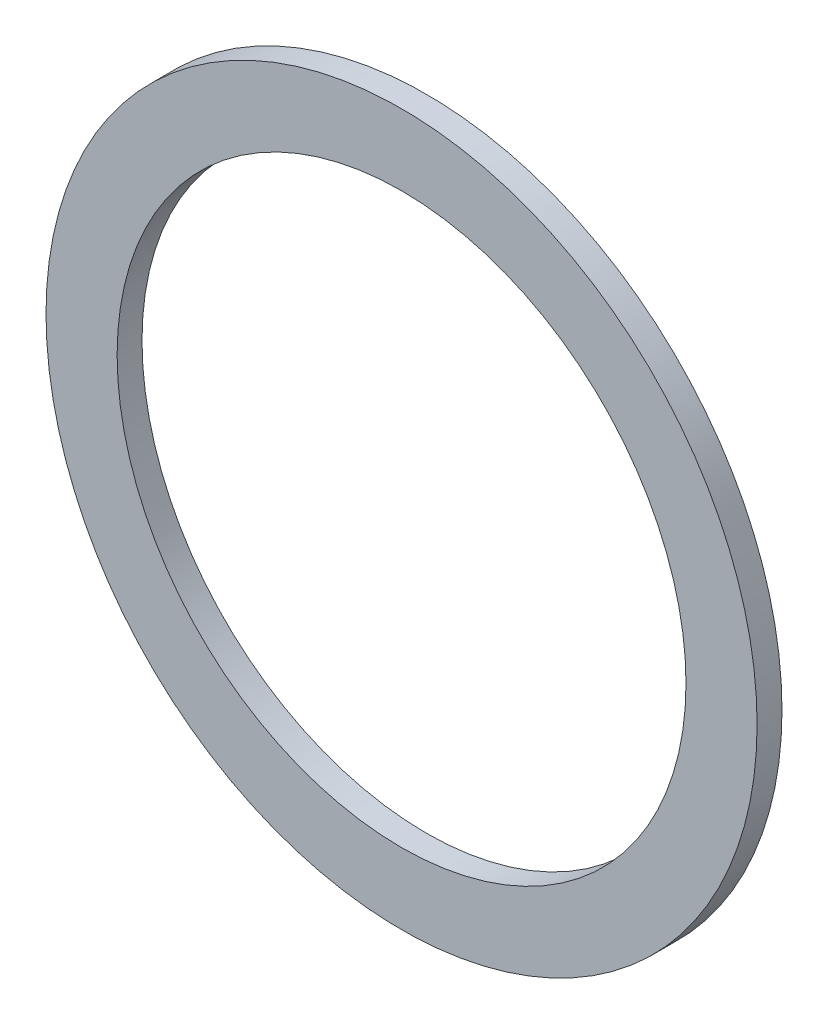
from build123d import *

# Parameters (mm, degrees)
SKETCH_1_R      = 100
SKETCH_1_R_2    = 80
EXTRUDE_1_DEPTH = 7


with BuildPart() as part:
    # 草图1 → 凸台-拉伸1 (new body)
    with BuildSketch(Plane.XY):
        Circle(SKETCH_1_R)
        Circle(SKETCH_1_R_2, mode=Mode.SUBTRACT)
    extrude(amount=EXTRUDE_1_DEPTH)


solid = part.part
